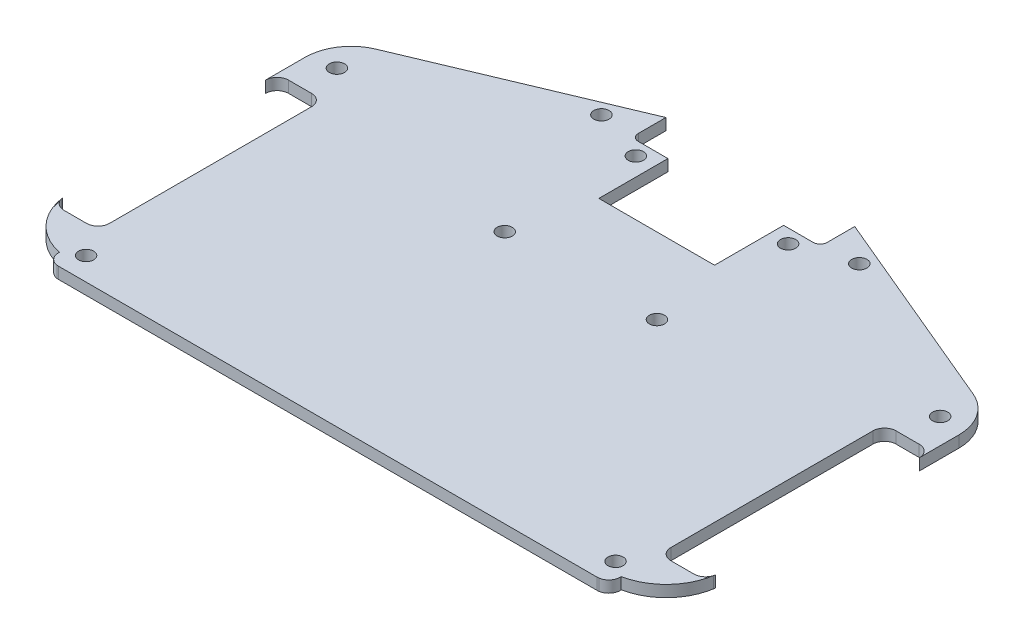
from build123d import *

# Parameters (mm, degrees)
SKETCH2_R                = 3.3
RESSALTO_EXTRUS_O3_DEPTH = 2.5


with BuildPart() as part:
    # Sketch2 → Ressalto-extrusão3 (new, symmetric)
    with BuildSketch(Plane(origin=(0, 0, 0), x_dir=(1, 0, 0), z_dir=(0, 1, 0))):
        with BuildLine():
            Line((41, 93.908069032), (129.747283843, 56.619294308))
            ThreePointArc((129.747283843, 56.619294308), (138.657515974, 49.24995754), (142, 38.180758763))
            Line((142, 38.180758763), (142, 21.025190062))
            ThreePointArc((142, 21.025190062), (140.46792235, 24.627066597), (136.810594171, 26.021601317))
            Line((136.810594171, 26.021601317), (126.810594815, 26.025190062))
            ThreePointArc((126.810594815, 26.025190062), (123.275060909, 24.560723968), (121.810594815, 21.025190062))
            Line((121.810594815, 21.025190062), (121.810594815, -66.724809938))
            ThreePointArc((121.810594815, -66.724809938), (123.275060909, -70.260343844), (126.810594815, -71.724809938))
            Line((126.810594815, -71.724809938), (136.810594815, -71.724809938))
            ThreePointArc((136.810594815, -71.724809938), (140.09446004, -70.495251448), (141.763243519, -67.411301611))
            ThreePointArc((141.763243519, -67.411301611), (135.224391149, -81.092334042), (121.981084486, -88.47759418))
            ThreePointArc((121.981084486, -88.47759418), (120.944283966, -91.984987628), (117.797013197, -93.84817061))
            ThreePointArc((117.797013197, -93.84817061), (117.3987196, -93.882791886), (117, -93.91210234))
            Line((117, -93.91210234), (-117, -93.91210234))
            ThreePointArc((-117, -93.91210234), (-117.3987196, -93.882791886), (-117.797013197, -93.84817061))
            ThreePointArc((-117.797013197, -93.84817061), (-120.944283966, -91.984987628), (-121.981084486, -88.47759418))
            ThreePointArc((-121.981084486, -88.47759418), (-135.224391149, -81.092334042), (-141.763243519, -67.411301611))
            ThreePointArc((-141.763243519, -67.411301611), (-140.09446004, -70.495251448), (-136.810594815, -71.724809938))
            Line((-136.810594815, -71.724809938), (-127, -71.724809938))
            ThreePointArc((-127, -71.724809938), (-123.464466094, -70.260343844), (-122, -66.724809938))
            Line((-122, -66.724809938), (-122, 21.025190062))
            ThreePointArc((-122, 21.025190062), (-123.464466094, 24.560723968), (-127, 26.025190062))
            Line((-127, 26.025190062), (-137, 26.025190062))
            ThreePointArc((-137, 26.025190062), (-140.535533906, 24.560723968), (-142, 21.025190062))
            Line((-142, 21.025190062), (-142, 38.180758763))
            ThreePointArc((-142, 38.180758763), (-138.657515974, 49.24995754), (-129.747283843, 56.619294308))
            Line((-129.747283843, 56.619294308), (-41, 93.908069032))
            Line((-41, 93.908069032), (-41, 81.908069032))
            ThreePointArc((-41, 81.908069032), (-40.121320344, 79.786748689), (-38, 78.908069032))
            Line((-38, 78.908069032), (-25.12, 78.908069032))
            Line((-25.12, 78.908069032), (-25.12, 48.908069032))
            Line((-25.12, 48.908069032), (25.12, 48.908069032))
            Line((25.12, 48.908069032), (25.12, 78.908069032))
            Line((25.12, 78.908069032), (38, 78.908069032))
            ThreePointArc((38, 78.908069032), (40.121320344, 79.786748689), (41, 81.908069032))
            Line((41, 81.908069032), (41, 93.908069032))
        make_face()
        with Locations(Location((-33.06, 15.954790167, 0), (0, 0, 270))):
            Circle(SKETCH2_R, mode=Mode.SUBTRACT)
        with Locations(Location((33.06, 15.954790032, 0), (0, 0, 270))):
            Circle(SKETCH2_R, mode=Mode.SUBTRACT)
        with Locations(Location((33.06, 72.908069032, 0), (0, 0, 270))):
            Circle(SKETCH2_R, mode=Mode.SUBTRACT)
        with Locations(Location((-33.06, 72.908069032, 0), (0, 0, 270))):
            Circle(SKETCH2_R, mode=Mode.SUBTRACT)
        with Locations(Location((-56, 80.908069032, 0), (0, 0, 270))):
            Circle(SKETCH2_R, mode=Mode.SUBTRACT)
        with Locations(Location((-131, 41.025190062, 0), (0, 0, 270))):
            Circle(SKETCH2_R, mode=Mode.SUBTRACT)
        with Locations(Location((56, 80.908069032, 0), (0, 0, 270))):
            Circle(SKETCH2_R, mode=Mode.SUBTRACT)
        with Locations(Location((131, 41.025190062, 0), (0, 0, 270))):
            Circle(SKETCH2_R, mode=Mode.SUBTRACT)
        with Locations(Location((115, -83.974809938, 0), (0, 0, 270))):
            Circle(SKETCH2_R, mode=Mode.SUBTRACT)
        with Locations(Location((-115, -83.908069032, 0), (0, 0, 270))):
            Circle(SKETCH2_R, mode=Mode.SUBTRACT)
    extrude(amount=RESSALTO_EXTRUS_O3_DEPTH, both=True)


solid = part.part
